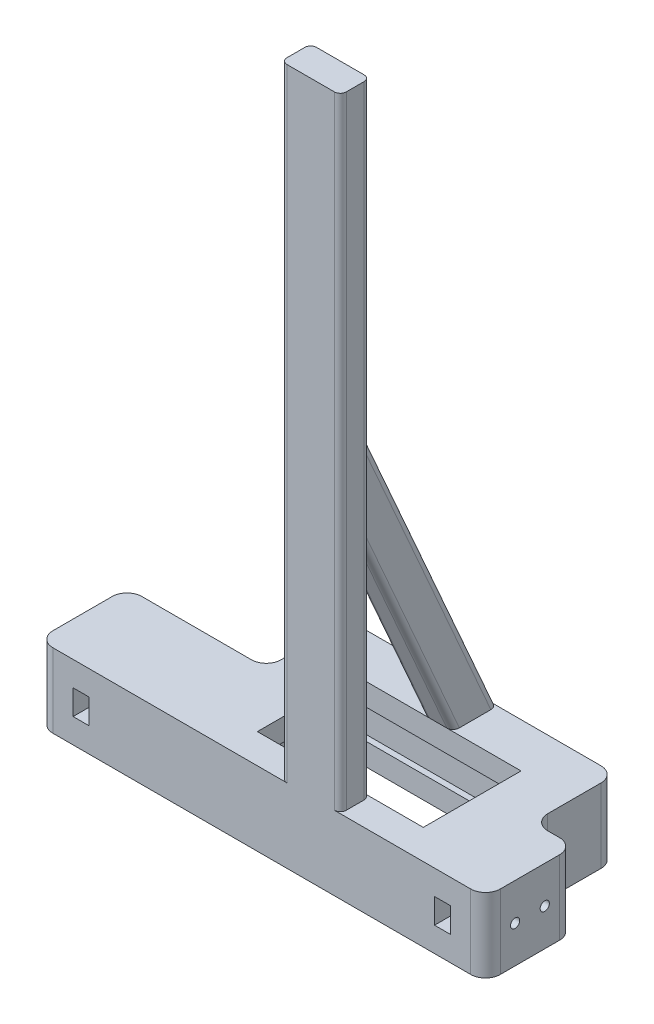
from build123d import *

# Parameters (mm, degrees)
SKETCH1_W                  = 151
SKETCH1_H                  = 58
SKETCH1_W_2                = 76
SKETCH1_H_2                = 38
BOSS_EXTRUDE1_DEPTH        = 25
SKETCH2_W                  = 76
SKETCH2_H                  = 10
CUT_EXTRUDE1_DEPTH         = 2
SKETCH3_W                  = 40
SKETCH3_H                  = 10
CUT_EXTRUDE2_DEPTH         = 2
SKETCH4_W                  = 76
SKETCH4_H                  = 7.5
BOSS_EXTRUDE2_DEPTH        = 5
SKETCH6_W                  = 20
SKETCH6_H                  = 10
BOSS_EXTRUDE3_DEPTH        = 210
SKETCH7_W                  = 10
SKETCH7_H                  = 7.5
BOSS_EXTRUDE4_DEPTH        = 33
BOSS_EXTRUDE5_DEPTH        = 5
FILLET2_R                  = 2
M2_5_CLEARANCE_HOLE1_D     = 3.1
M2_5_CLEARANCE_HOLE1_DEPTH = 16.068666041
M2_5_CLEARANCE_HOLE1_TIP   = 0.931333959
M2_5_CLEARANCE_HOLE2_D     = 3.1
M2_5_CLEARANCE_HOLE2_DEPTH = 16.068666041
M2_5_CLEARANCE_HOLE2_TIP   = 0.931333959
SKETCH19_W                 = 5
SKETCH19_H                 = 8
SKETCH19_W_2               = 5.4
SKETCH19_H_2               = 8.4
CUT_EXTRUDE4_DEPTH         = 25.2
SKETCH25_W                 = 47
SKETCH25_H                 = 28
SKETCH25_W_2               = 14
CUT_EXTRUDE5_DEPTH         = 255.02755756
FILLET3_R                  = 5


with BuildPart() as part:
    # Sketch1 → Boss-Extrude1 (new body)
    with BuildSketch(Plane(origin=(0, 0, 0), x_dir=(1, 0, 0), z_dir=(0, 1, 0))):
        with Locations((-16.5, 0)):
            Rectangle(SKETCH1_W, SKETCH1_H)
        with Locations((0, -5)):
            Rectangle(SKETCH1_W_2, SKETCH1_H_2, mode=Mode.SUBTRACT)
    extrude(amount=BOSS_EXTRUDE1_DEPTH)

    # Sketch2 → Cut-Extrude1 (cut)
    with BuildSketch(Plane.XY.offset(-14)):
        with Locations((0, 12.5)):
            Rectangle(SKETCH2_W, SKETCH2_H)
    extrude(amount=-CUT_EXTRUDE1_DEPTH, mode=Mode.SUBTRACT)

    # Sketch3 → Cut-Extrude2 (cut)
    with BuildSketch(Plane(origin=(-38, 0, 0), x_dir=(0, 0, -1), z_dir=(1, 0, 0))):
        with Locations((-4, 12.5)):
            Rectangle(SKETCH3_W, SKETCH3_H)
    cut_extrude2 = extrude(amount=-CUT_EXTRUDE2_DEPTH, mode=Mode.SUBTRACT)

    # Mirror1: Cut-Extrude2 across plane
    add(cut_extrude2.mirror(Plane(origin=(0, 0, 0), x_dir=(0, 0, 1), z_dir=(1, 0, 0))), mode=Mode.SUBTRACT)

    # Sketch4 → Boss-Extrude2 (add)
    with BuildSketch(Plane(origin=(0, 0, 24), x_dir=(-1, 0, 0), z_dir=(0, 0, -1))):
        with Locations((0, 21.25)):
            Rectangle(SKETCH4_W, SKETCH4_H)
    extrude(amount=BOSS_EXTRUDE2_DEPTH)

    # Sketch6 → Boss-Extrude3 (add)
    with BuildSketch(Plane(origin=(0, 25, 0), x_dir=(1, 0, 0), z_dir=(0, 1, 0))):
        with Locations((0, -24)):
            Rectangle(SKETCH6_W, SKETCH6_H)
    extrude(amount=BOSS_EXTRUDE3_DEPTH)

    # Sketch7 → Boss-Extrude4 (add)
    with BuildSketch(Plane(origin=(0, 0, 19), x_dir=(-1, 0, 0), z_dir=(0, 0, -1))):
        with Locations((-33, 21.25)):
            Rectangle(SKETCH7_W, SKETCH7_H)
        with Locations((33, 21.25)):
            Rectangle(SKETCH7_W, SKETCH7_H)
    extrude(amount=BOSS_EXTRUDE4_DEPTH)

    # Sketch8 → Boss-Extrude5 (add, symmetric)
    with BuildSketch(Plane(origin=(0, 0, 0), x_dir=(0, 0, -1), z_dir=(1, 0, 0))):
        Polygon((-19, 134.090909091), (29, 25), (14, 25), (-19, 100), align=None)
    extrude(amount=BOSS_EXTRUDE5_DEPTH, both=True)

    # Fillet2
    fillet2_edges = [part.edges().sort_by_distance(p)[0] for p in [
        (-5, 62.5, 2.5),
        (-5, 79.545454545, -5),
        (5, 62.5, 2.5),
        (5, 79.545454545, -5),
        (10, 130, 29),
        (10, 130, 19),
        (-10, 130, 19),
        (-10, 130, 29),
    ]]
    fillet(fillet2_edges, radius=FILLET2_R)

    # M2.5 Clearance Hole1
    with Locations(Plane(origin=(59, 0, 0), x_dir=(0, 0, -1), z_dir=(1, 0, 0))):
        with Locations((-19, 12.5), (-9, 12.5)):
            Hole(M2_5_CLEARANCE_HOLE1_D / 2, depth=M2_5_CLEARANCE_HOLE1_DEPTH)
            with Locations((0, 0, -(M2_5_CLEARANCE_HOLE1_DEPTH + M2_5_CLEARANCE_HOLE1_TIP / 2))):  # 118° drill point
                Cone(0, M2_5_CLEARANCE_HOLE1_D / 2, M2_5_CLEARANCE_HOLE1_TIP, mode=Mode.SUBTRACT)

    # M2.5 Clearance Hole2
    with Locations(Plane.ZY.offset(92)):
        with Locations((9, 12.5), (19, 12.5)):
            Hole(M2_5_CLEARANCE_HOLE2_D / 2, depth=M2_5_CLEARANCE_HOLE2_DEPTH)
            with Locations((0, 0, -(M2_5_CLEARANCE_HOLE2_DEPTH + M2_5_CLEARANCE_HOLE2_TIP / 2))):  # 118° drill point
                Cone(0, M2_5_CLEARANCE_HOLE2_D / 2, M2_5_CLEARANCE_HOLE2_TIP, mode=Mode.SUBTRACT)

    # Sketch19 → Cut-Extrude4 (cut)
    with BuildSketch(Plane.XY.offset(29)):
        with Locations((44.5, 12.5)):
            Rectangle(SKETCH19_W, SKETCH19_H)
        with Locations((44.5, 12.5)):
            Rectangle(SKETCH19_W_2, SKETCH19_H_2)
        with Locations((-77.5, 12.5)):
            Rectangle(SKETCH19_W_2, SKETCH19_H_2)
    extrude(amount=-CUT_EXTRUDE4_DEPTH, mode=Mode.SUBTRACT)

    # Sketch25 → Cut-Extrude5 (cut, through all)
    with BuildSketch(Plane.XZ):
        with Locations((-68.5, -15)):
            Rectangle(SKETCH25_W, SKETCH25_H)
        with Locations((52, -15)):
            Rectangle(SKETCH25_W_2, SKETCH25_H)
    extrude(amount=-CUT_EXTRUDE5_DEPTH, mode=Mode.SUBTRACT)

    # Fillet3
    fillet3_edges = [part.edges().sort_by_distance(p)[0] for p in [
        (-92, 12.5, -1),
        (45, 12.5, -29),
        (-45, 12.5, -1),
        (-45, 12.5, -29),
        (45, 12.5, -1),
        (59, 12.5, -1),
        (59, 12.5, 29),
        (-92, 12.5, 29),
    ]]
    fillet(fillet3_edges, radius=FILLET3_R)


solid = part.part
